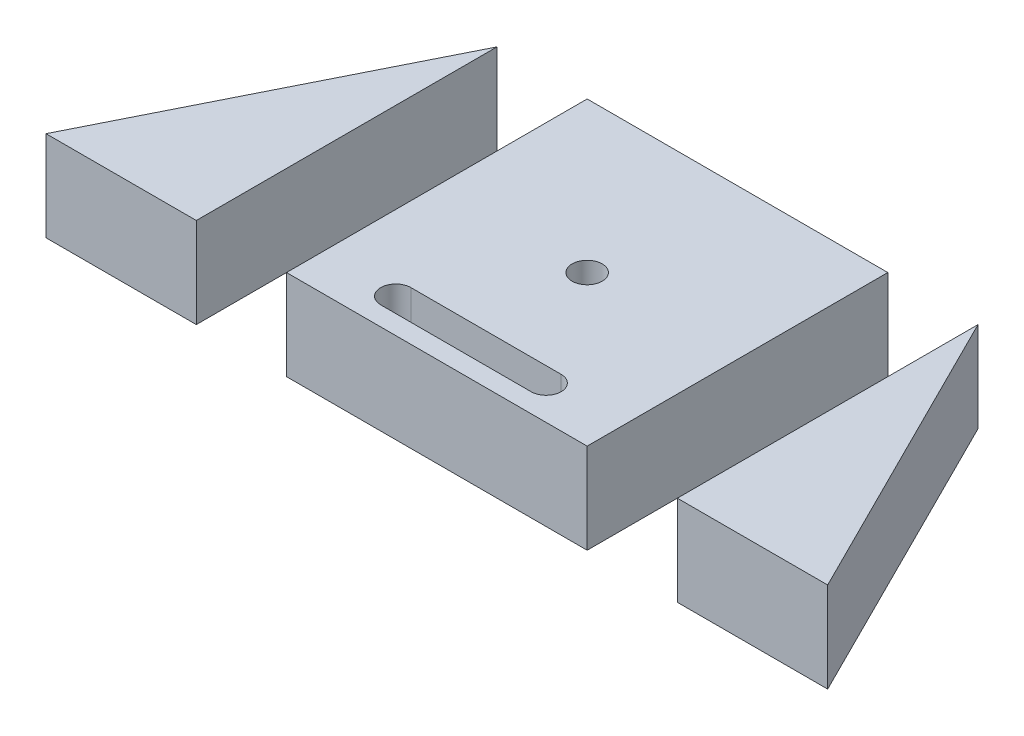
from build123d import *

# Parameters (mm, degrees)
EXTRUDE_1_DEPTH     = 30
SKETCH_1_W          = 100
SKETCH_1_H          = 100
EXTRUDE_1_2_DEPTH   = 30
SKETCH_2_R          = 5
CUT_EXTRUDE_1_DEPTH = 10


with BuildPart() as part:
    # 草图1 → 凸台-拉伸1 (new body)
    with BuildSketch(Plane(origin=(0, 0, 0), x_dir=(1, 0, 0), z_dir=(0, 1, 0))):
        Polygon((80, -50), (130, -50), (80, 50), align=None)
    extrude(amount=EXTRUDE_1_DEPTH)


with BuildPart() as body_2:
    # 草图1 → Extrude 1 2 (new body)
    with BuildSketch(Plane(origin=(0, 0, 0), x_dir=(1, 0, 0), z_dir=(0, 1, 0))):
        Rectangle(SKETCH_1_W, SKETCH_1_H)
    extrude(amount=EXTRUDE_1_2_DEPTH)

    # 草图2 → 切除-拉伸1 (cut)
    with BuildSketch(Plane(origin=(0, 30, 0), x_dir=(1, 0, 0), z_dir=(0, 1, 0))):
        with Locations(Location((0, 0, 0), (0, 0, 270))):
            Circle(SKETCH_2_R)
        with BuildLine():
            Line((-25, -33.649292644), (25, -33.649292644))
            ThreePointArc((25, -33.649292644), (30, -38.649292644), (25, -43.649292644))
            Line((25, -43.649292644), (-25, -43.649292644))
            ThreePointArc((-25, -43.649292644), (-30, -38.649292644), (-25, -33.649292644))
        make_face()
    extrude(amount=-CUT_EXTRUDE_1_DEPTH, mode=Mode.SUBTRACT)


with BuildPart() as body_3:
    # 镜向1: mirrored copy
    add(part.part.mirror(Plane(origin=(0, 0, 0), x_dir=(0, 0, 1), z_dir=(1, 0, 0))))


solid = Compound([part.part, body_2.part, body_3.part])
